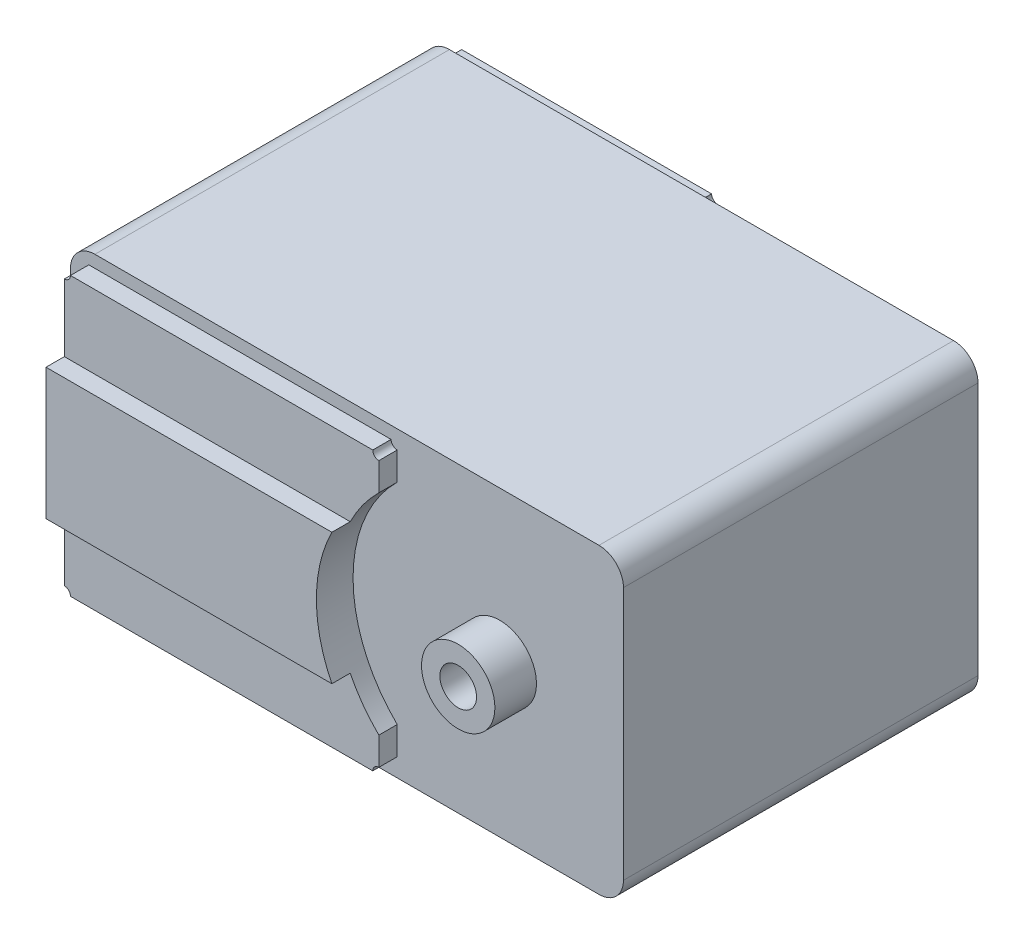
from build123d import *

# Parameters (mm, degrees)
SKETCH_1_W          = 45.23
SKETCH_1_H          = 24.73
EXTRUDE_1_DEPTH     = 29
FILLET_1_R          = 2
SKETCH_2_R          = 3
EXTRUDE_2_DEPTH     = 3.4
SKETCH_3_R          = 1.5
CUT_EXTRUDE_1_DEPTH = 6
SKETCH_4_W          = 25.725975672
SKETCH_4_H          = 22.73
EXTRUDE_3_DEPTH     = 1.5
SKETCH_5_R          = 0.5
CUT_EXTRUDE_2_DEPTH = 1.5
CUT_EXTRUDE_3_DEPTH = 1.5
EXTRUDE_START       = 1.5
EXTRUDE_4_DEPTH     = 1.5
SKETCH_21_W         = 21.4387918
SKETCH_21_H         = 22.73
EXTRUDE_11_DEPTH    = 1.5
CUT_EXTRUDE_START   = -1.5
SKETCH_23_R         = 0.5
CUT_EXTRUDE_4_DEPTH = 1.5
SKETCH_24_W         = 18.4387918
SKETCH_24_H         = 18.73
EXTRUDE_12_DEPTH    = 1.5
FILLET_2_R          = 2
SKETCH_25_R         = 3
EXTRUDE_13_DEPTH    = 4.1
SKETCH_26_R         = 1.5
CUT_EXTRUDE_5_DEPTH = 4.1
SKETCH_27_W         = 4
SKETCH_27_H         = 18.73
CUT_EXTRUDE_6_DEPTH = 3


with BuildPart() as part:
    # 草图1 → 凸台-拉伸1 (new body)
    with BuildSketch(Plane.XY):
        Rectangle(SKETCH_1_W, SKETCH_1_H)
    extrude(amount=EXTRUDE_1_DEPTH)

    # 圆角1
    fillet_1_edges = [part.edges().sort_by_distance(p)[0] for p in [
        (22.615, -12.365, 14.5),
        (-22.615, -12.365, 14.5),
        (-22.615, 12.365, 14.5),
        (22.615, 12.365, 14.5),
    ]]
    fillet(fillet_1_edges, radius=FILLET_1_R)

    # 草图2 → 凸台-拉伸2 (add)
    with BuildSketch(Plane.XY.offset(29)):
        with Locations(Location((12.5, 0, 0), (0, 0, 180))):
            Circle(SKETCH_2_R)
    extrude(amount=EXTRUDE_2_DEPTH)

    # 草图3 → 切除-拉伸1 (cut)
    with BuildSketch(Plane.XY.offset(32.4)):
        with Locations((12.5, 0)):
            Circle(SKETCH_3_R)
    extrude(amount=-CUT_EXTRUDE_1_DEPTH, mode=Mode.SUBTRACT)

    # 草图4 → 凸台-拉伸3 (add)
    with BuildSketch(Plane.XY.offset(29)):
        with Locations((-8.752012164, 0)):
            Rectangle(SKETCH_4_W, SKETCH_4_H)
    extrude(amount=EXTRUDE_3_DEPTH)

    # 草图5 → 切除-拉伸2 (cut)
    with BuildSketch(Plane.XY.offset(30.5)):
        with Locations((-21.615, 11.365)):
            Circle(SKETCH_5_R)
        with Locations((4.110975672, 11.365)):
            Circle(SKETCH_5_R)
        with Locations((-21.615, -11.365)):
            Circle(SKETCH_5_R)
        with Locations((4.110975672, -11.365)):
            Circle(SKETCH_5_R)
    extrude(amount=-CUT_EXTRUDE_2_DEPTH, mode=Mode.SUBTRACT)

    # 草图6 → 切除-拉伸3 (cut)
    with BuildSketch(Plane.XY.offset(30.5)):
        with BuildLine():
            Line((4.110975672, -8.580458661), (4.110975672, 8.580458661))
            ThreePointArc((4.110975672, 8.580458661), (0.5, 0), (4.110975672, -8.580458661))
        make_face()
    extrude(amount=-CUT_EXTRUDE_3_DEPTH, mode=Mode.SUBTRACT)

    # 草图7 → 凸台-拉伸4 (add)
    with BuildSketch(Plane.XY.offset(30.5).offset(EXTRUDE_START)):
        with BuildLine():
            Line((-21.615, 5.365), (1.766092277, 5.365))
            ThreePointArc((1.766092277, 5.365), (0.5, 0), (1.766092277, -5.365))
            Line((1.766092277, -5.365), (-21.615, -5.365))
            Line((-21.615, -5.365), (-21.615, 5.365))
        make_face()
    extrude(amount=-EXTRUDE_4_DEPTH)

    # 草图21 → 凸台-拉伸11 (add)
    with BuildSketch(Plane(origin=(-20.629587366, 0.959657155, 0), x_dir=(-1, 0, 0), z_dir=(0, 0, -1))):
        with Locations((-9.733983266, -0.959657155)):
            Rectangle(SKETCH_21_W, SKETCH_21_H)
    extrude(amount=EXTRUDE_11_DEPTH)

    # 草图23 → 切除-拉伸4 (cut)
    with BuildSketch(Plane(origin=(-20.629587366, 0.959657155, -1.5), x_dir=(-1, 0, 0), z_dir=(0, 0, -1)).offset(CUT_EXTRUDE_START)):
        with Locations((-20.453379166, 10.405342845)):
            Circle(SKETCH_23_R)
        with Locations((0.985412634, 10.405342845)):
            Circle(SKETCH_23_R)
        with Locations((-20.453379166, -12.324657155)):
            Circle(SKETCH_23_R)
        with Locations((0.985412634, -12.324657155)):
            Circle(SKETCH_23_R)
    extrude(amount=CUT_EXTRUDE_4_DEPTH, mode=Mode.SUBTRACT)

    # 草图24 → 凸台-拉伸12 (add)
    with BuildSketch(Plane(origin=(0, 0, -1.5), x_dir=(-1, 0, 0), z_dir=(0, 0, -1))):
        with Locations((9.3956041, 0)):
            Rectangle(SKETCH_24_W, SKETCH_24_H)
    extrude(amount=EXTRUDE_12_DEPTH)

    # 圆角2
    fillet_2_edges = [part.edges().sort_by_distance(p)[0] for p in [
        (-0.1762082, 0, -3),
    ]]
    fillet(fillet_2_edges, radius=FILLET_2_R)

    # 草图25 → 凸台-拉伸13 (add)
    with BuildSketch(Plane(origin=(0, 0, 0), x_dir=(-1, 0, 0), z_dir=(0, 0, -1))):
        with Locations((-12.365, 0)):
            Circle(SKETCH_25_R)
    extrude(amount=EXTRUDE_13_DEPTH)

    # 草图26 → 切除-拉伸5 (cut)
    with BuildSketch(Plane(origin=(0, 0, -4.1), x_dir=(-1, 0, 0), z_dir=(0, 0, -1))):
        with Locations((-12.365, 0)):
            Circle(SKETCH_26_R)
    extrude(amount=-CUT_EXTRUDE_5_DEPTH, mode=Mode.SUBTRACT)

    # 草图27 → 切除-拉伸6 (cut)
    with BuildSketch(Plane(origin=(0, 0, 0), x_dir=(-1, 0, 0), z_dir=(0, 0, -1))):
        with Locations((-2.8237918, 0)):
            Rectangle(SKETCH_27_W, SKETCH_27_H)
    extrude(amount=-CUT_EXTRUDE_6_DEPTH, mode=Mode.SUBTRACT)


solid = part.part
